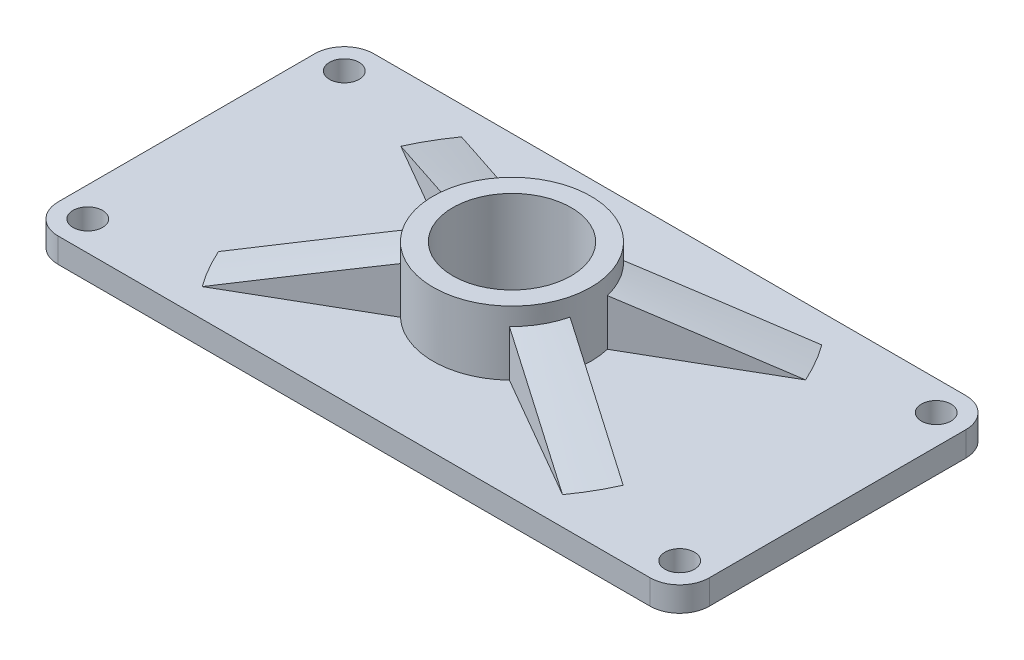
from build123d import *

# Parameters (mm, degrees)
SKETCH1_R           = 12
BOSS_EXTRUDE1_DEPTH = 18
SKETCH1_3_R         = 3
BOSS_EXTRUDE2_DEPTH = 5
BOSS_EXTRUDE4_DEPTH = 18


with BuildPart() as part:
    # Sketch1 → Boss-Extrude1 (new body)
    with BuildSketch(Plane(origin=(0, 0, 0), x_dir=(1, 0, 0), z_dir=(0, 1, 0))):
        with BuildLine():
            ThreePointArc((-15.547086147, -3.779961949), (-13.856406461, -8), (-11.047086147, -11.574190583))
            ThreePointArc((-11.047086147, -11.574190583), (0, -16), (11.047086147, -11.574190583))
            ThreePointArc((11.047086147, -11.574190583), (13.856406461, -8), (15.547086147, -3.779961949))
            ThreePointArc((15.547086147, -3.779961949), (15.88636803, -1.903499625), (16, 0))
            ThreePointArc((16, 0), (15.88636803, 1.903499625), (15.547086147, 3.779961949))
            ThreePointArc((15.547086147, 3.779961949), (13.856406461, 8), (11.047086147, 11.574190583))
            ThreePointArc((11.047086147, 11.574190583), (0, 16), (-11.047086147, 11.574190583))
            ThreePointArc((-11.047086147, 11.574190583), (-13.856406461, 8), (-15.547086147, 3.779961949))
            ThreePointArc((-15.547086147, 3.779961949), (-16, 0), (-15.547086147, -3.779961949))
        make_face()
        Circle(SKETCH1_R, mode=Mode.SUBTRACT)
    extrude(amount=BOSS_EXTRUDE1_DEPTH)

    # Sketch1<3> → Boss-Extrude2 (add)
    with BuildSketch(Plane(origin=(0, 0, 0), x_dir=(1, 0, 0), z_dir=(0, 1, 0))):
        with BuildLine():
            ThreePointArc((-60, 32), (-64.242640687, 30.242640687), (-66, 26))
            Line((-66, 26), (-66, -26))
            ThreePointArc((-66, -26), (-64.242640687, -30.242640687), (-60, -32))
            Line((-60, -32), (60, -32))
            ThreePointArc((60, -32), (64.242640687, -30.242640687), (66, -26))
            Line((66, -26), (66, 26))
            ThreePointArc((66, 26), (64.242640687, 30.242640687), (60, 32))
            Line((60, 32), (-60, 32))
        make_face()
        with Locations((-60, -26)):
            Circle(SKETCH1_3_R, mode=Mode.SUBTRACT)
        with Locations((60, -26)):
            Circle(SKETCH1_3_R, mode=Mode.SUBTRACT)
        with Locations((-60, 26)):
            Circle(SKETCH1_3_R, mode=Mode.SUBTRACT)
        with BuildLine():
            ThreePointArc((11.047086147, -11.574190583), (0, -16), (-11.047086147, -11.574190583))
            Line((-11.047086147, -11.574190583), (-36.72114317, -26.397114317))
            Line((-36.72114317, -26.397114317), (-41.22114317, -18.602885683))
            Line((-41.22114317, -18.602885683), (-15.547086147, -3.779961949))
            ThreePointArc((-15.547086147, -3.779961949), (-16, 0), (-15.547086147, 3.779961949))
            Line((-15.547086147, 3.779961949), (-41.22114317, 18.602885683))
            Line((-41.22114317, 18.602885683), (-36.72114317, 26.397114317))
            Line((-36.72114317, 26.397114317), (-11.047086147, 11.574190583))
            ThreePointArc((-11.047086147, 11.574190583), (0, 16), (11.047086147, 11.574190583))
            Line((11.047086147, 11.574190583), (36.72114317, 26.397114317))
            Line((36.72114317, 26.397114317), (41.22114317, 18.602885683))
            Line((41.22114317, 18.602885683), (15.547086147, 3.779961949))
            ThreePointArc((15.547086147, 3.779961949), (15.88636803, 1.903499625), (16, 0))
            ThreePointArc((16, 0), (15.88636803, -1.903499625), (15.547086147, -3.779961949))
            Line((15.547086147, -3.779961949), (41.22114317, -18.602885683))
            Line((41.22114317, -18.602885683), (36.72114317, -26.397114317))
            Line((36.72114317, -26.397114317), (11.047086147, -11.574190583))
        make_face(mode=Mode.SUBTRACT)
        with Locations((60, 26)):
            Circle(SKETCH1_3_R, mode=Mode.SUBTRACT)
    extrude(amount=BOSS_EXTRUDE2_DEPTH)

    # Sketch1<6> → Boss-Extrude4 (add)
    with BuildSketch(Plane(origin=(0, 0, 0), x_dir=(1, 0, 0), z_dir=(0, 1, 0))):
        with BuildLine():
            Line((-36.72114317, -26.397114317), (-11.047086147, -11.574190583))
            ThreePointArc((-11.047086147, -11.574190583), (-13.856406461, -8), (-15.547086147, -3.779961949))
            Line((-15.547086147, -3.779961949), (-41.22114317, -18.602885683))
            Line((-41.22114317, -18.602885683), (-36.72114317, -26.397114317))
        make_face()
        with BuildLine():
            ThreePointArc((15.547086147, -3.779961949), (13.856406461, -8), (11.047086147, -11.574190583))
            Line((11.047086147, -11.574190583), (36.72114317, -26.397114317))
            Line((36.72114317, -26.397114317), (41.22114317, -18.602885683))
            Line((41.22114317, -18.602885683), (15.547086147, -3.779961949))
        make_face()
        with BuildLine():
            Line((-41.22114317, 18.602885683), (-15.547086147, 3.779961949))
            ThreePointArc((-15.547086147, 3.779961949), (-13.856406461, 8), (-11.047086147, 11.574190583))
            Line((-11.047086147, 11.574190583), (-36.72114317, 26.397114317))
            Line((-36.72114317, 26.397114317), (-41.22114317, 18.602885683))
        make_face()
        with BuildLine():
            Line((36.72114317, 26.397114317), (11.047086147, 11.574190583))
            ThreePointArc((11.047086147, 11.574190583), (13.856406461, 8), (15.547086147, 3.779961949))
            Line((15.547086147, 3.779961949), (41.22114317, 18.602885683))
            Line((41.22114317, 18.602885683), (36.72114317, 26.397114317))
        make_face()
    extrude(amount=BOSS_EXTRUDE4_DEPTH)

    # Sketch18 → Cut-Revolve4 (revolve, cut)
    with BuildSketch(Plane(origin=(0, 0, 0), x_dir=(0, -1, 0), z_dir=(-1, 0, 0))):
        Polygon((-18, 16), (-14.422671191, 16), (-5, 45), (-5, 47.498753947), (-18, 47.498753947), align=None)
    revolve(axis=Axis((0, 18.9, 0), (0, -1, 0)), mode=Mode.SUBTRACT)


solid = part.part
